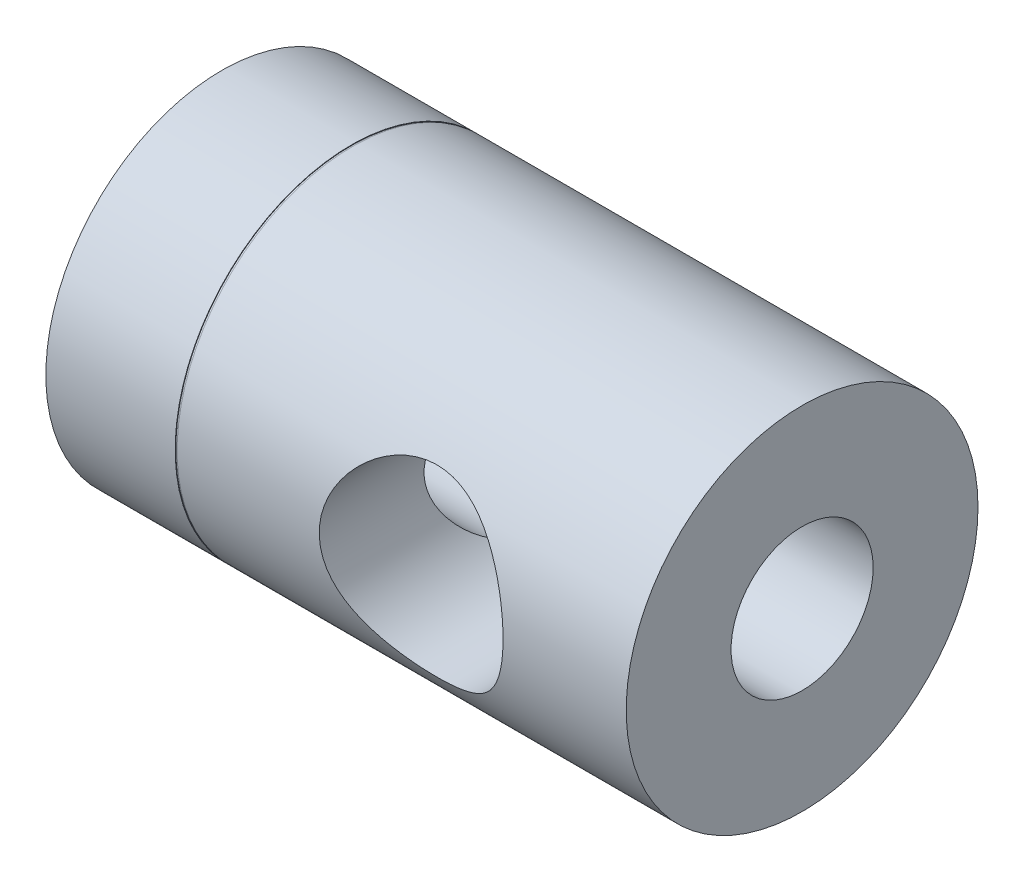
from build123d import *

# Parameters (mm, degrees)
CUT_EXTRUDE1_DEPTH      = 24.305927409
CUT_EXTRUDE1_DEPTH_BACK = 24.305927409
SKETCH2_R               = 4.9276


with BuildPart() as part:
    # Sketch1 → Revolve1 (revolve)
    with BuildSketch(Plane.XY, mode=Mode.PRIVATE) as revolve1_sk:
        Polygon((-1.7145, 3.81), (15.6845, 3.81), (15.6845, 9.42975), (-8.3947, 9.42975), (-8.3947, 9.398), (-8.4455, 9.398), (-8.4963, 9.398), (-8.4963, 9.42975), (-15.4305, 9.42975), (-19.1135, 3.81), align=None)
    revolve(revolve1_sk.sketch.rotate(Axis((0, 0, 0), (-1, 0, 0)), 90), axis=Axis((0, 0, 0), (-1, 0, 0)))

    # Sketch2 → Cut-Extrude1 (cut, two sides: drawn at the far end of the back side and taken through both)
    with BuildSketch(Plane.XY.offset(-CUT_EXTRUDE1_DEPTH_BACK)):
        with Locations((4.1529, 0)):
            Circle(SKETCH2_R)
    extrude(amount=CUT_EXTRUDE1_DEPTH + CUT_EXTRUDE1_DEPTH_BACK, mode=Mode.SUBTRACT)


solid = part.part
